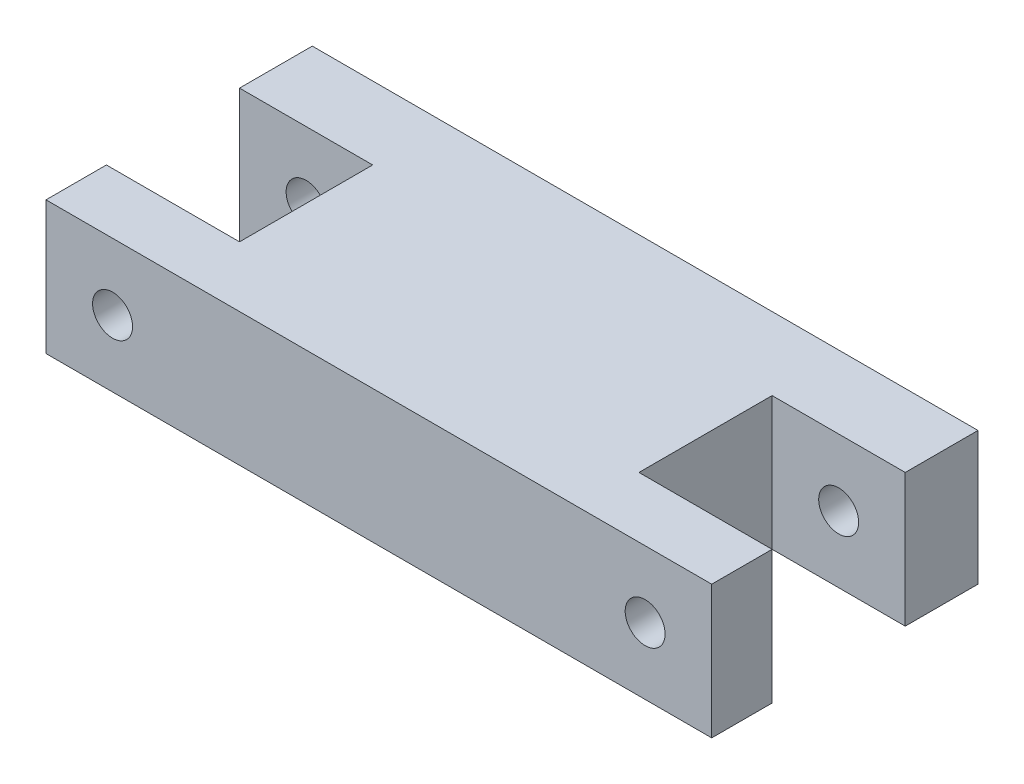
from build123d import *

# Parameters (mm, degrees)
SKETCH_1_W               = 100
SKETCH_1_H               = 20
EXTRUDE_1_DEPTH          = 40
CUT_EXTRUDE_1_DEPTH      = 68.082039325
SKETCH_4_R               = 3
CUT_EXTRUDE_2_DEPTH      = 59.695433862
MIRROR_3_COPY_1_SKETCH_R = 3
MIRROR_3_COPY_1_DEPTH    = 59.695433862


with BuildPart() as part:
    # 草图1 → 凸台-拉伸1 (new body)
    with BuildSketch(Plane.XY):
        Rectangle(SKETCH_1_W, SKETCH_1_H)
    extrude(amount=EXTRUDE_1_DEPTH)

    # 草图2 → 切除-拉伸1 (cut, through all)
    with BuildSketch(Plane(origin=(0, 10, 0), x_dir=(1, 0, 0), z_dir=(0, 1, 0))):
        Polygon((50, -10.928468285), (50, -20.928468285), (50, -30.928468285), (30, -30.928468285), (30, -10.928468285), align=None)
    cut_extrude_1 = extrude(amount=-CUT_EXTRUDE_1_DEPTH, mode=Mode.SUBTRACT)

    # 镜向1: 切除-拉伸1 across plane
    add(cut_extrude_1.mirror(Plane(origin=(0, 0, 0), x_dir=(0, 0, 1), z_dir=(1, 0, 0))), mode=Mode.SUBTRACT)

    # 草图4 → 切除-拉伸2 (cut, through all)
    with BuildSketch(Plane.XY.offset(10.928468285)):
        with Locations((40, 0)):
            Circle(SKETCH_4_R)
    cut_extrude_2 = extrude(amount=-CUT_EXTRUDE_2_DEPTH, mode=Mode.SUBTRACT)

    # 镜向2: 切除-拉伸2 across plane
    add(cut_extrude_2.mirror(Plane(origin=(0, 0, 0), x_dir=(0, 0, 1), z_dir=(1, 0, 0))), mode=Mode.SUBTRACT)

    # 镜向3: 切除-拉伸2 across plane
    add(cut_extrude_2.mirror(Plane.XY.offset(20)), mode=Mode.SUBTRACT)

    # 镜向3 copy 1 sketch → 镜向3 copy 1 (cut, through all)
    with BuildSketch(Plane(origin=(0, 0, 29.071531715), x_dir=(-1, 0, 0), z_dir=(0, 0, -1))):
        with Locations((40, 0)):
            Circle(MIRROR_3_COPY_1_SKETCH_R)
    extrude(amount=-MIRROR_3_COPY_1_DEPTH, mode=Mode.SUBTRACT)


solid = part.part
